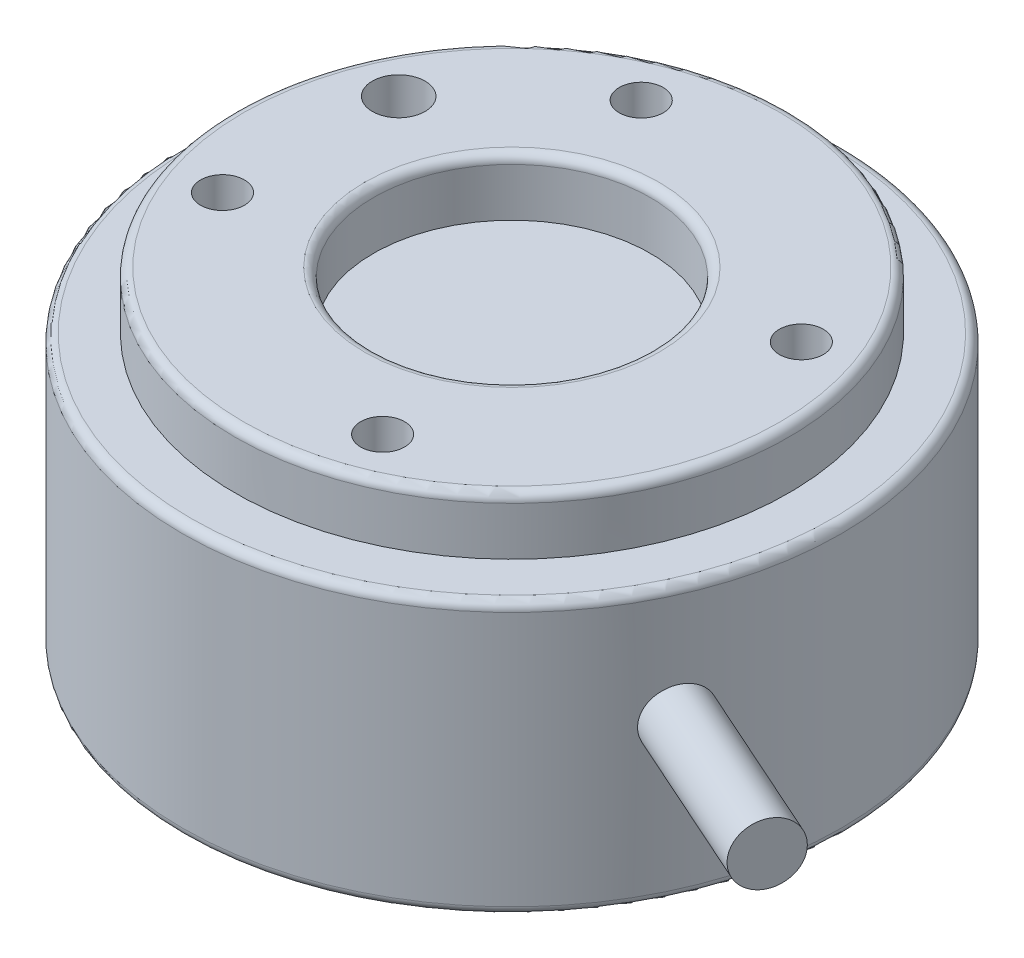
from build123d import *

# Parameters (mm, degrees)
SKETCH_1_R           = 37.5
EXTRUDE_1_DEPTH      = 31
SKETCH_2_R           = 31.5
EXTRUDE_2_DEPTH      = 6.5
SKETCH_3_R           = 15.75
CUT_EXTRUDE_1_DEPTH  = 6.5
SKETCH_4_R           = 15.8
EXTRUDE_3_DEPTH      = 6.2
HOLE_WIZARD_M6_1_D   = 5
MM_1_D               = 6
MM_1_DEPTH           = 6
MM_1_TIP             = 1.802581857
EXTRUDE_4_REACH      = 116.985
EXTRUDE_4_END_RADIUS = 37.5
SKETCH_16_R          = 3.457756213
FILLET_2_R           = 1


with BuildPart() as part:
    # 草图1 → 凸台-拉伸1 (new body)
    with BuildSketch(Plane(origin=(0, 0, 0), x_dir=(1, 0, 0), z_dir=(0, 1, 0))):
        with Locations(Location((0, 0, 0), (0, 0, 270))):
            Circle(SKETCH_1_R)
    extrude(amount=EXTRUDE_1_DEPTH)

    # 草图2 → 凸台-拉伸2 (add)
    with BuildSketch(Plane(origin=(0, 31, 0), x_dir=(1, 0, 0), z_dir=(0, 1, 0))):
        with Locations(Location((0, 0, 0), (0, 0, 90))):
            Circle(SKETCH_2_R)
    extrude(amount=EXTRUDE_2_DEPTH)

    # 草图3 → 切除-拉伸1 (cut)
    with BuildSketch(Plane(origin=(0, 37.5, 0), x_dir=(1, 0, 0), z_dir=(0, 1, 0))):
        with Locations(Location((0, 0, 0), (0, 0, 270))):
            Circle(SKETCH_3_R)
    extrude(amount=-CUT_EXTRUDE_1_DEPTH, mode=Mode.SUBTRACT)

    # 草图4 → 凸台-拉伸3 (add)
    with BuildSketch(Plane.XZ):
        with Locations(Location((0, 0, 0), (0, 0, 90))):
            Circle(SKETCH_4_R)
    extrude(amount=EXTRUDE_3_DEPTH)

    # M6 螺纹孔1 (through all)
    with Locations(Plane(origin=(0, 37.5, 0), x_dir=(1, 0, 0), z_dir=(0, 1, 0))):
        with Locations((-23.818134331, -9.107495647), (9.107495647, -23.818134331), (23.818134331, 9.107495647), (-9.107495647, 23.818134331)):
            Hole(HOLE_WIZARD_M6_1_D / 2)

    # 大小mm 暗销孔1
    with Locations(Plane(origin=(0, 37.5, 0), x_dir=(1, 0, 0), z_dir=(0, 1, 0))):
        with Locations((-23.281936233, 10.401992369)):
            Hole(MM_1_D / 2, depth=MM_1_DEPTH)
            with Locations((0, 0, -(MM_1_DEPTH + MM_1_TIP / 2))):  # 118° drill point
                Cone(0, MM_1_D / 2, MM_1_TIP, mode=Mode.SUBTRACT)

    # 凸台-拉伸4: up to this cylinder (the profile starts outside it)
    extrude_4_end = Plane(origin=(0, 17.698511, 0), z_dir=(0, -1, 0)) * Cylinder(EXTRUDE_4_END_RADIUS, 309.97, mode=Mode.PRIVATE)
    # 草图16 → 凸台-拉伸4 (add, up to the surface)
    with BuildSketch(Plane(origin=(52.498483662, 0, 23.455472989), x_dir=(0.4079212693781409, 0, -0.9130171071721089), z_dir=(0.9130171071721089, 0, 0.4079212693781409)), mode=Mode.PRIVATE) as extrude_4_sk1:
        with Locations((0, 17.698511035)):
            Circle(SKETCH_16_R)
    extrude_4_tool1 = extrude(extrude_4_sk1.sketch, amount=-EXTRUDE_4_REACH, mode=Mode.PRIVATE) - extrude_4_end
    add(extrude_4_tool1.solids().sort_by_distance((52.498484, 17.698511, 23.455473))[0])

    # 圆角2
    fillet_2_edges = [part.edges().sort_by_distance(p)[0] for p in [
        (0, 37.5, -15.75),
        (0, 0, -37.5),
        (0, 31, -37.5),
        (0, 37.5, 31.5),
    ]]
    fillet(fillet_2_edges, radius=FILLET_2_R)


solid = part.part
